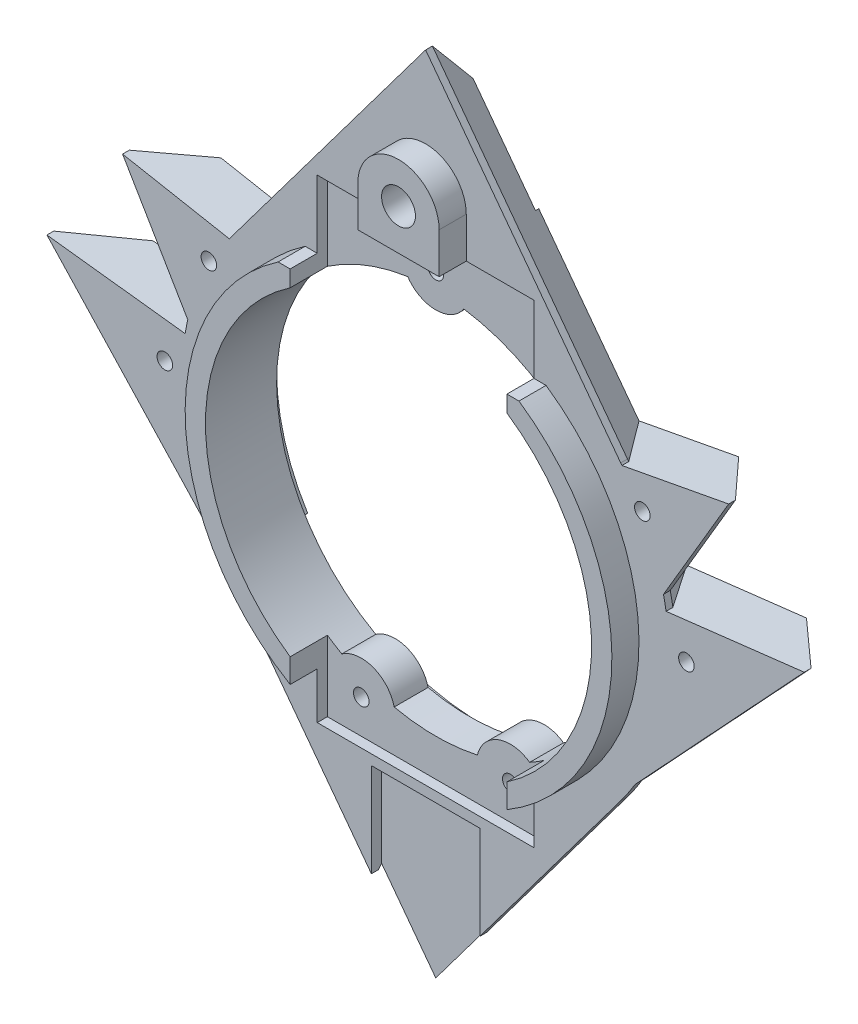
from build123d import *
from OCP.BRepFilletAPI import BRepFilletAPI_MakeChamfer

# Parameters (mm, degrees)
EXTRUDE_1_DEPTH          = 8
CHAMFER_12_SIZE          = 7
CHAMFER_12_SIZE2         = 5
SKETCH_11_R              = 30
CUT_EXTRUDE_1_DEPTH      = 1.5
EXTRUDE_5_DEPTH          = 8
EXTRUDE_5_2_DEPTH        = 8
EXTRUDE_5_3_DEPTH        = 8
EXTRUDE_5_4_DEPTH        = 8
CHAMFER_13_SIZE          = 5
CHAMFER_13_SIZE2         = 7
CHAMFER_14_SIZE          = 5
CHAMFER_14_SIZE2         = 7
CHAMFER_15_SIZE          = 7
CHAMFER_15_SIZE2         = 5
CHAMFER_16_SIZE          = 5
CHAMFER_16_SIZE2         = 7
SKETCH_23_W              = 32
SKETCH_23_H              = 70
CUT_EXTRUDE_7_DEPTH      = 1.5
SKETCH_13_W              = 16
SKETCH_13_H              = 26
CUT_EXTRUDE_2_DEPTH      = 1.5
HOLE_WIZARD_M2_24_D      = 2.3
HOLE_WIZARD_M2_24_DEPTH  = 3.5
HOLE_WIZARD_M2_24_TIP    = 0.690989712
EXTRUDE_6_DEPTH          = 4
HOLE_WIZARD_M2_25_D      = 2.3
HOLE_WIZARD_M2_25_DEPTH  = 4
HOLE_WIZARD_M2_25_TIP    = 0.690989712
CUT_EXTRUDE_8_DEPTH      = 83.880013818
CUT_EXTRUDE_8_DEPTH_BACK = 83.880013818
SKETCH_32_R              = 2.5
SKETCH_33_W              = 16
SKETCH_33_H              = 1.5
EXTRUDE_7_DEPTH          = 1.5
SKETCH_34_R              = 6
SKETCH_34_R_2            = 2.5
EXTRUDE_8_DEPTH          = 4
CUT_EXTRUDE_9_DEPTH      = 1
SKETCH_15_R              = 35
SKETCH_15_R_2            = 17.5
CUT_EXTRUDE_10_DEPTH     = 1
CHAMFER_18_SIZE          = 1.5


with BuildPart() as part:
    # Эскиз1 → Бобышка-Вытянуть1 (new body)
    with BuildSketch(Plane.XY):
        with BuildLine():
            Line((28.8, 21.6), (0, 60))
            Line((0, 60), (-28.8, 21.6))
            ThreePointArc((-28.8, 21.6), (-36, 0), (-28.8, -21.6))
            Line((-28.8, -21.6), (0, -60))
            Line((0, -60), (28.8, -21.6))
            ThreePointArc((28.8, -21.6), (36, 0), (28.8, 21.6))
        make_face()
        with BuildLine():
            ThreePointArc((4.1408267, 28.197580645), (28.033938924, 5.133056438), (13.863257821, -24.901005654))
            ThreePointArc((13.863257821, -24.901005654), (9.226728829, -24.325012368), (6.138561306, -27.831062953))
            ThreePointArc((6.138561306, -27.831062953), (0, -28.5), (-6.138561306, -27.831062953))
            ThreePointArc((-6.138561306, -27.831062953), (-9.226728829, -24.325012368), (-13.863257821, -24.901005654))
            ThreePointArc((-13.863257821, -24.901005654), (-28.033938924, 5.133056438), (-4.1408267, 28.197580645))
            ThreePointArc((-4.1408267, 28.197580645), (0, 26), (4.1408267, 28.197580645))
        make_face(mode=Mode.SUBTRACT)
    extrude(amount=EXTRUDE_1_DEPTH)

    # Фаска12: one chamfer whose edges measure the first distance from different faces: ONE call of the kernel's chamfer builder (chamfer() names one face for all edges)
    chamfer_12_edges_1 = [part.edges().sort_by_distance(p)[0] for p in [
        (14.4, 40.8, 0),
    ]]
    chamfer_12_side_1 = [part.faces().sort_by_distance(p)[0] for p in [
        (14.4, 40.8, 4),
    ]]
    chamfer_12_edges_2 = [part.edges().sort_by_distance(p)[0] for p in [
        (36, 0, 0),
    ]]
    chamfer_12_side_2 = [part.faces().sort_by_distance(p)[0] for p in [
        (36, 0, 4),
    ]]
    chamfer_12_edges_3 = [part.edges().sort_by_distance(p)[0] for p in [
        (14.4, -40.8, 0),
    ]]
    chamfer_12_side_3 = [part.faces().sort_by_distance(p)[0] for p in [
        (14.4, -40.8, 4),
    ]]
    chamfer_12_edges_4 = [part.edges().sort_by_distance(p)[0] for p in [
        (-14.4, -40.8, 0),
    ]]
    chamfer_12_side_4 = [part.faces().sort_by_distance(p)[0] for p in [
        (-14.4, -40.8, 4),
    ]]
    chamfer_12_edges_5 = [part.edges().sort_by_distance(p)[0] for p in [
        (-36, 0, 0),
    ]]
    chamfer_12_side_5 = [part.faces().sort_by_distance(p)[0] for p in [
        (-36, 0, 4),
    ]]
    chamfer_12_edges_6 = [part.edges().sort_by_distance(p)[0] for p in [
        (-14.4, 40.8, 0),
    ]]
    chamfer_12_side_6 = [part.faces().sort_by_distance(p)[0] for p in [
        (-14.4, 40.8, 4),
    ]]
    chamfer_12 = BRepFilletAPI_MakeChamfer(part.part.solid().wrapped)
    for e in chamfer_12_edges_1:
        chamfer_12.Add(CHAMFER_12_SIZE, CHAMFER_12_SIZE2, e.wrapped, chamfer_12_side_1[0].wrapped)  # the first distance lies on this face
    for e in chamfer_12_edges_2:
        chamfer_12.Add(CHAMFER_12_SIZE, CHAMFER_12_SIZE2, e.wrapped, chamfer_12_side_2[0].wrapped)  # the first distance lies on this face
    for e in chamfer_12_edges_3:
        chamfer_12.Add(CHAMFER_12_SIZE, CHAMFER_12_SIZE2, e.wrapped, chamfer_12_side_3[0].wrapped)  # the first distance lies on this face
    for e in chamfer_12_edges_4:
        chamfer_12.Add(CHAMFER_12_SIZE, CHAMFER_12_SIZE2, e.wrapped, chamfer_12_side_4[0].wrapped)  # the first distance lies on this face
    for e in chamfer_12_edges_5:
        chamfer_12.Add(CHAMFER_12_SIZE, CHAMFER_12_SIZE2, e.wrapped, chamfer_12_side_5[0].wrapped)  # the first distance lies on this face
    for e in chamfer_12_edges_6:
        chamfer_12.Add(CHAMFER_12_SIZE, CHAMFER_12_SIZE2, e.wrapped, chamfer_12_side_6[0].wrapped)  # the first distance lies on this face
    add(Compound.cast(chamfer_12.Shape()), mode=Mode.REPLACE)

    # Эскиз11 → Вырез-Вытянуть1 (cut)
    with BuildSketch(Plane(origin=(0, 0, 0), x_dir=(-1, 0, 0), z_dir=(0, 0, -1))):
        Circle(SKETCH_11_R)
    extrude(amount=-CUT_EXTRUDE_1_DEPTH, mode=Mode.SUBTRACT)


with BuildPart() as body_2:
    # Эскиз17 → Бобышка-Вытянуть5 (new body)
    with BuildSketch(Plane(origin=(0, 0, 8), x_dir=(-1, 0, 0), z_dir=(0, 0, -1))):
        with BuildLine():
            Line((25.238858928, -18), (28.902564257, -20.612903226))
            Line((28.902564257, -20.612903226), (55.902564257, 8.387096774))
            Line((55.902564257, 8.387096774), (30.528334189, 5.387096774))
            ThreePointArc((30.528334189, 5.387096774), (30.236303195, -6.838564841), (25.238858928, -18))
        make_face()
    extrude(amount=EXTRUDE_5_DEPTH)

    # Фаска13
    chamfer_13_edges = [body_2.edges().sort_by_distance(p)[0] for p in [
        (-42.402564257, -6.112903226, 0),
    ]]
    chamfer_13_side = [body_2.faces().sort_by_distance(p)[0] for p in [
        (-38.046204164, -3.085883691, 0),
    ]]
    chamfer(chamfer_13_edges, length=CHAMFER_13_SIZE, length2=CHAMFER_13_SIZE2, reference=chamfer_13_side[0])


with BuildPart() as body_3:
    # Эскиз17 → Extrude 5 2 (new body)
    with BuildSketch(Plane(origin=(0, 0, 8), x_dir=(-1, 0, 0), z_dir=(0, 0, -1))):
        with BuildLine():
            Line((-28.902564257, -20.612903226), (-25.238858928, -18))
            ThreePointArc((-25.238858928, -18), (-30.236303195, -6.838564841), (-30.528334189, 5.387096774))
            Line((-30.528334189, 5.387096774), (-55.902564257, 8.387096774))
            Line((-55.902564257, 8.387096774), (-28.902564257, -20.612903226))
        make_face()
    extrude(amount=EXTRUDE_5_2_DEPTH)

    # Фаска14
    chamfer_14_edges = [body_3.edges().sort_by_distance(p)[0] for p in [
        (42.402564257, -6.112903226, 0),
    ]]
    chamfer_14_side = [body_3.faces().sort_by_distance(p)[0] for p in [
        (38.046204164, -3.085883691, 0),
    ]]
    chamfer(chamfer_14_edges, length=CHAMFER_14_SIZE, length2=CHAMFER_14_SIZE2, reference=chamfer_14_side[0])


with BuildPart() as body_4:
    # Эскиз17 → Extrude 5 3 (new body)
    with BuildSketch(Plane(origin=(0, 0, 8), x_dir=(-1, 0, 0), z_dir=(0, 0, -1))):
        with BuildLine():
            ThreePointArc((23.416468646, 20.314255983), (27.763165047, 13.791543298), (30.334880827, 6.387096774))
            Line((30.334880827, 6.387096774), (34.73833127, 7.314255983))
            Line((34.73833127, 7.314255983), (44.73833127, 24.314255983))
            Line((44.73833127, 24.314255983), (23.416468646, 20.314255983))
        make_face()
    extrude(amount=EXTRUDE_5_3_DEPTH)

    # Фаска16
    chamfer_16_edges = [body_4.edges().sort_by_distance(p)[0] for p in [
        (-39.73833127, 15.814255983, 0),
    ]]
    chamfer_16_side = [body_4.faces().sort_by_distance(p)[0] for p in [
        (-33.811855358, 16.430209574, 0),
    ]]
    chamfer(chamfer_16_edges, length=CHAMFER_16_SIZE, length2=CHAMFER_16_SIZE2, reference=chamfer_16_side[0])


with BuildPart() as body_5:
    # Эскиз17 → Extrude 5 4 (new body)
    with BuildSketch(Plane(origin=(0, 0, 8), x_dir=(-1, 0, 0), z_dir=(0, 0, -1))):
        with BuildLine():
            Line((-34.73833127, 7.314255983), (-30.334880827, 6.387096774))
            ThreePointArc((-30.334880827, 6.387096774), (-27.763165047, 13.791543298), (-23.416468646, 20.314255983))
            Line((-23.416468646, 20.314255983), (-44.73833127, 24.314255983))
            Line((-44.73833127, 24.314255983), (-34.73833127, 7.314255983))
        make_face()
    extrude(amount=EXTRUDE_5_4_DEPTH)

    # Фаска15
    chamfer_15_edges = [body_5.edges().sort_by_distance(p)[0] for p in [
        (39.73833127, 15.814255983, 0),
    ]]
    chamfer_15_side = [body_5.faces().sort_by_distance(p)[0] for p in [
        (39.73833127, 15.814255983, 4),
    ]]
    chamfer(chamfer_15_edges, length=CHAMFER_15_SIZE, length2=CHAMFER_15_SIZE2, reference=chamfer_15_side[0])


with BuildPart() as body_2_1:
    add(body_2.part)

    # Combine 2: union body 3, body 5, body 4, part
    add(body_3.part)
    add(body_5.part)
    add(body_4.part)
    add(part.part)

    # Эскиз23 → Вырез-Вытянуть7 (cut)
    with BuildSketch(Plane.XY.offset(8)):
        with Locations((0, 1)):
            Rectangle(SKETCH_23_W, SKETCH_23_H)
    extrude(amount=-CUT_EXTRUDE_7_DEPTH, mode=Mode.SUBTRACT)

    # Эскиз13 → Вырез-Вытянуть2 (cut)
    with BuildSketch(Plane.XY.offset(8)):
        with Locations((0, -47)):
            Rectangle(SKETCH_13_W, SKETCH_13_H)
    extrude(amount=-CUT_EXTRUDE_2_DEPTH, mode=Mode.SUBTRACT)

    # Сверло под метчик  спиральное M2.24
    with Locations(Plane.XY.offset(6.5)):
        with Locations((0, 31), (-11, -29), (11, -29)):
            Hole(HOLE_WIZARD_M2_24_D / 2, depth=HOLE_WIZARD_M2_24_DEPTH)
            with Locations((0, 0, -(HOLE_WIZARD_M2_24_DEPTH + HOLE_WIZARD_M2_24_TIP / 2))):  # 118° drill point
                Cone(0, HOLE_WIZARD_M2_24_D / 2, HOLE_WIZARD_M2_24_TIP, mode=Mode.SUBTRACT)

    # Эскиз28 → Бобышка-Вытянуть6 (add)
    with BuildSketch(Plane.XY.offset(8)):
        with BuildLine():
            Line((-16, 23.58495283), (-16, 26))
            Line((-16, 26), (-17.783419244, 26))
            ThreePointArc((-17.783419244, 26), (-31.482271301, -1.056689982), (-16, -27.133927102))
            Line((-16, -27.133927102), (-16, -23.58495283))
            ThreePointArc((-16, -23.58495283), (-28.5, 0), (-16, 23.58495283))
        make_face()
        with BuildLine():
            Line((17.783419244, 26), (16, 26))
            Line((16, 26), (16, 23.58495283))
            ThreePointArc((16, 23.58495283), (28.5, 0), (16, -23.58495283))
            Line((16, -23.58495283), (16, -27.133927102))
            ThreePointArc((16, -27.133927102), (31.482271301, -1.056689982), (17.783419244, 26))
        make_face()
    extrude(amount=EXTRUDE_6_DEPTH)

    # Сверло под метчик  спиральное M2.25
    with Locations(Plane.XY.offset(8)):
        with Locations((-32, 17), (-38.5, 1), (32, 17), (38.5, 1)):
            Hole(HOLE_WIZARD_M2_25_D / 2, depth=HOLE_WIZARD_M2_25_DEPTH)
            with Locations((0, 0, -(HOLE_WIZARD_M2_25_DEPTH + HOLE_WIZARD_M2_25_TIP / 2))):  # 118° drill point
                Cone(0, HOLE_WIZARD_M2_25_D / 2, HOLE_WIZARD_M2_25_TIP, mode=Mode.SUBTRACT)

    # Эскиз32 → Вырез-Вытянуть8 (cut, two sides: drawn at the far end of the back side and taken through both)
    with BuildSketch(Plane(origin=(0, 0, 0), x_dir=(-1, 0, 0), z_dir=(0, 0, -1)).offset(-CUT_EXTRUDE_8_DEPTH_BACK)):
        with Locations((0, 42)):
            Circle(SKETCH_32_R)
    extrude(amount=CUT_EXTRUDE_8_DEPTH + CUT_EXTRUDE_8_DEPTH_BACK, mode=Mode.SUBTRACT)

    # Эскиз33 → Бобышка-Вытянуть7 (add)
    with BuildSketch(Plane.XY.offset(6.5)):
        with Locations((0, -34.75)):
            Rectangle(SKETCH_33_W, SKETCH_33_H)
    extrude(amount=EXTRUDE_7_DEPTH)

    # Эскиз34 → Бобышка-Вытянуть8 (add)
    # profile 1 of 3: a face of its own
    with BuildSketch(Plane.XY.offset(8)):
        with Locations((0, 42)):
            Circle(SKETCH_34_R)
        with Locations(Location((0, 42, 0), (0, 0, 180))):
            Circle(SKETCH_34_R_2, mode=Mode.SUBTRACT)
    # profile 2 of 3: a face of its own
    with BuildSketch(Plane.XY.offset(8)):
        with BuildLine():
            Line((6, 36), (6, 42))
            ThreePointArc((6, 42), (4.242640713, 37.757359339), (7.3e-08, 36))
            Line((7.3e-08, 36), (6, 36))
        make_face()
    # profile 3 of 3: a face of its own
    with BuildSketch(Plane.XY.offset(8)):
        with BuildLine():
            ThreePointArc((7.3e-08, 36), (-4.242640661, 37.757359287), (-6, 42))
            Line((-6, 42), (-6, 36))
            Line((-6, 36), (7.3e-08, 36))
        make_face()
    extrude(amount=EXTRUDE_8_DEPTH)

    # Эскиз18 → Вырез-Вытянуть9 (cut)
    with BuildSketch(Plane(origin=(0, 0, 0), x_dir=(-1, 0, 0), z_dir=(0, 0, -1))):
        with BuildLine():
            Line((-12.532635049, 43.289819934), (0, 60))
            Line((0, 60), (12.532635049, 43.289819934))
            ThreePointArc((12.532635049, 43.289819934), (6.179836993, 37.318603148), (1.5, 29.962476533))
            ThreePointArc((1.5, 29.962476533), (0, 30), (-1.5, 29.962476533))
            ThreePointArc((-1.5, 29.962476533), (-6.179836993, 37.318603148), (-12.532635049, 43.289819934))
        make_face()
    extrude(amount=-CUT_EXTRUDE_9_DEPTH, mode=Mode.SUBTRACT)

    # Эскиз15 → Вырез-Вытянуть10 (cut)
    with BuildSketch(Plane(origin=(0, 0, 0), x_dir=(-1, 0, 0), z_dir=(0, 0, -1))):
        with Locations((0, -40)):
            Circle(SKETCH_15_R)
        with Locations((0, -40)):
            Circle(SKETCH_15_R_2, mode=Mode.SUBTRACT)
    extrude(amount=-CUT_EXTRUDE_10_DEPTH, mode=Mode.SUBTRACT)

    # Фаска18
    chamfer_18_edges = [body_2_1.edges().sort_by_distance(p)[0] for p in [
        (2.5, 42, 1),
    ]]
    chamfer(chamfer_18_edges, length=CHAMFER_18_SIZE)


solid = body_2_1.part
